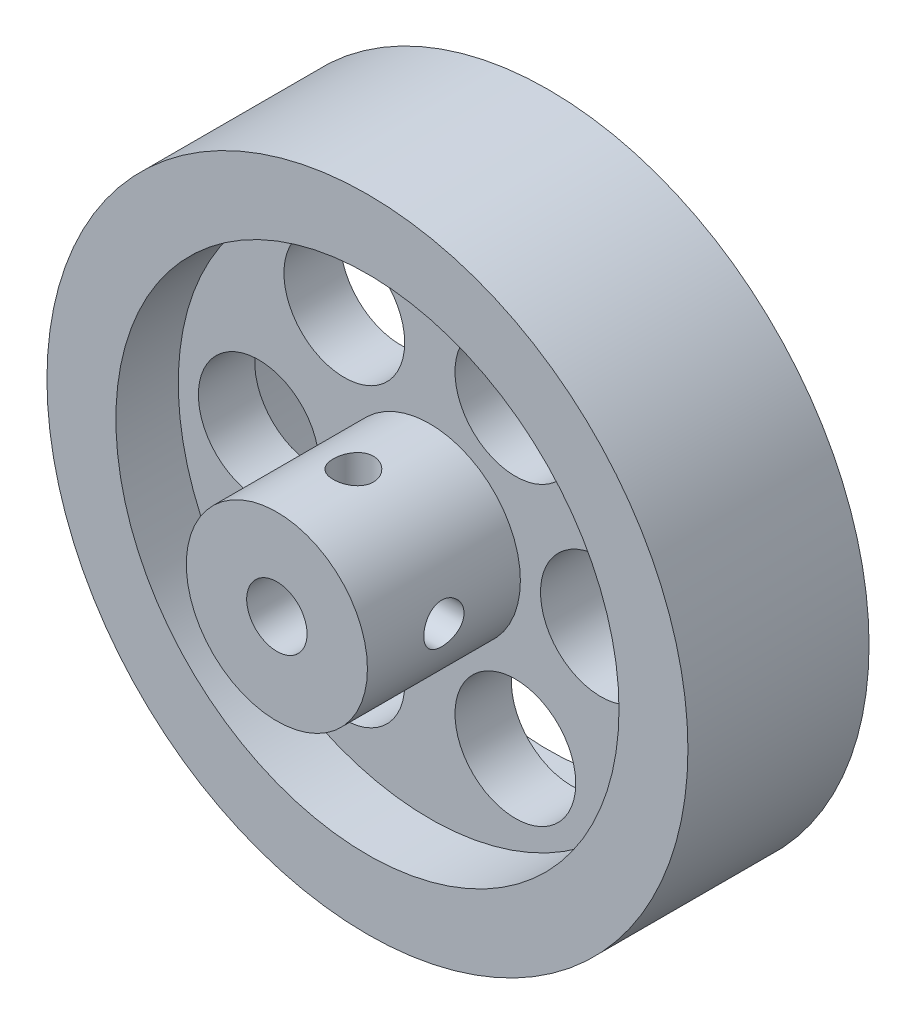
from build123d import *

# Parameters (mm, degrees)
SKETCH_1_R                = 31.85
EXTRUDE_1_DEPTH           = 18
SKETCH_2_R                = 25
SKETCH_2_R_2              = 9
CUT_EXTRUDE_1_DEPTH       = 6.2
CUT_EXTRUDE_START         = -6.2
SKETCH_3_R                = 25
SKETCH_3_R_2              = 9
CUT_EXTRUDE_5_DEPTH       = 6.2
EXTRUDE_START             = 9
SKETCH_4_R                = 9
EXTRUDE_2_DEPTH           = 9
SKETCH_5_R                = 3
CUT_EXTRUDE_6_DEPTH       = 53.515188279
SKETCH_6_R                = 6
CUT_EXTRUDE_7_DEPTH       = 48.538247759
CUT_EXTRUDE_10_REACH      = 60.414
CUT_EXTRUDE_10_END_RADIUS = 3
SKETCH_10_R               = 2
CUT_EXTRUDE_11_REACH      = 60.414
CUT_EXTRUDE_11_END_RADIUS = 3
SKETCH_7_R                = 2


with BuildPart() as part:
    # 草图1 → 凸台-拉伸1 (new body)
    with BuildSketch(Plane.XY):
        Circle(SKETCH_1_R)
    extrude(amount=EXTRUDE_1_DEPTH)

    # 草图2 → 切除-拉伸1 (cut)
    with BuildSketch(Plane.XY.offset(18)):
        Circle(SKETCH_2_R)
        Circle(SKETCH_2_R_2, mode=Mode.SUBTRACT)
    extrude(amount=-CUT_EXTRUDE_1_DEPTH, mode=Mode.SUBTRACT)

    # 草图3 → 切除-拉伸5 (cut)
    with BuildSketch(Plane(origin=(0, 0, 0), x_dir=(-1, 0, 0), z_dir=(0, 0, -1)).offset(CUT_EXTRUDE_START)):
        with Locations(Location((0, 0, 0), (0, 0, 180))):
            Circle(SKETCH_3_R)
        with Locations(Location((0, 0, 0), (0, 0, 180))):
            Circle(SKETCH_3_R_2, mode=Mode.SUBTRACT)
    extrude(amount=CUT_EXTRUDE_5_DEPTH, mode=Mode.SUBTRACT)

    # 草图4 → 凸台-拉伸2 (add)
    with BuildSketch(Plane.XY.offset(18).offset(EXTRUDE_START)):
        Circle(SKETCH_4_R)
    extrude(amount=-EXTRUDE_2_DEPTH)

    # 草图5 → 切除-拉伸6 (cut, through all)
    with BuildSketch(Plane.XY.offset(27)):
        Circle(SKETCH_5_R)
    extrude(amount=-CUT_EXTRUDE_6_DEPTH, mode=Mode.SUBTRACT)

    # 草图6 → 切除-拉伸7 (cut, through all)
    with BuildSketch(Plane.XY.offset(11.8)):
        with Locations((-17, 0)):
            Circle(SKETCH_6_R)
        with Locations((-8.5, 14.722431864)):
            Circle(SKETCH_6_R)
        with Locations((8.5, 14.722431864)):
            Circle(SKETCH_6_R)
        with Locations((17, 0)):
            Circle(SKETCH_6_R)
        with Locations((8.5, -14.722431864)):
            Circle(SKETCH_6_R)
        with Locations((-8.5, -14.722431864)):
            Circle(SKETCH_6_R)
    extrude(amount=-CUT_EXTRUDE_7_DEPTH, mode=Mode.SUBTRACT)

    # 切除-拉伸10: up to this cylinder (the profile starts outside it)
    cut_extrude_10_end = Plane(origin=(0, 0, 19.4), z_dir=(0, 0, 1)) * Cylinder(CUT_EXTRUDE_10_END_RADIUS, 127.828, mode=Mode.PRIVATE)
    # 草图10 → 切除-拉伸10 (cut, up to the surface)
    with BuildSketch(Plane(origin=(0, 9, 0), x_dir=(1, 0, 0), z_dir=(0, 1, 0)), mode=Mode.PRIVATE) as cut_extrude_10_sk1:
        with Locations(Location((0, -19.4, 0), (0, 0, 270))):
            Circle(SKETCH_10_R)
    cut_extrude_10_tool1 = extrude(cut_extrude_10_sk1.sketch, amount=-CUT_EXTRUDE_10_REACH, mode=Mode.PRIVATE) - cut_extrude_10_end
    add(cut_extrude_10_tool1.solids().sort_by_distance((0, 9, 19.4))[0], mode=Mode.SUBTRACT)

    # 切除-拉伸11: up to this cylinder (the profile starts outside it)
    cut_extrude_11_end = Plane(origin=(0, 0, 19.4), z_dir=(0, 0, 1)) * Cylinder(CUT_EXTRUDE_11_END_RADIUS, 127.828, mode=Mode.PRIVATE)
    # 草图7 → 切除-拉伸11 (cut, up to the surface)
    with BuildSketch(Plane(origin=(9, 0, 0), x_dir=(0, 0, -1), z_dir=(1, 0, 0)), mode=Mode.PRIVATE) as cut_extrude_11_sk1:
        with Locations((-19.4, 0)):
            Circle(SKETCH_7_R)
    cut_extrude_11_tool1 = extrude(cut_extrude_11_sk1.sketch, amount=-CUT_EXTRUDE_11_REACH, mode=Mode.PRIVATE) - cut_extrude_11_end
    add(cut_extrude_11_tool1.solids().sort_by_distance((9, 0, 19.4))[0], mode=Mode.SUBTRACT)


solid = part.part
